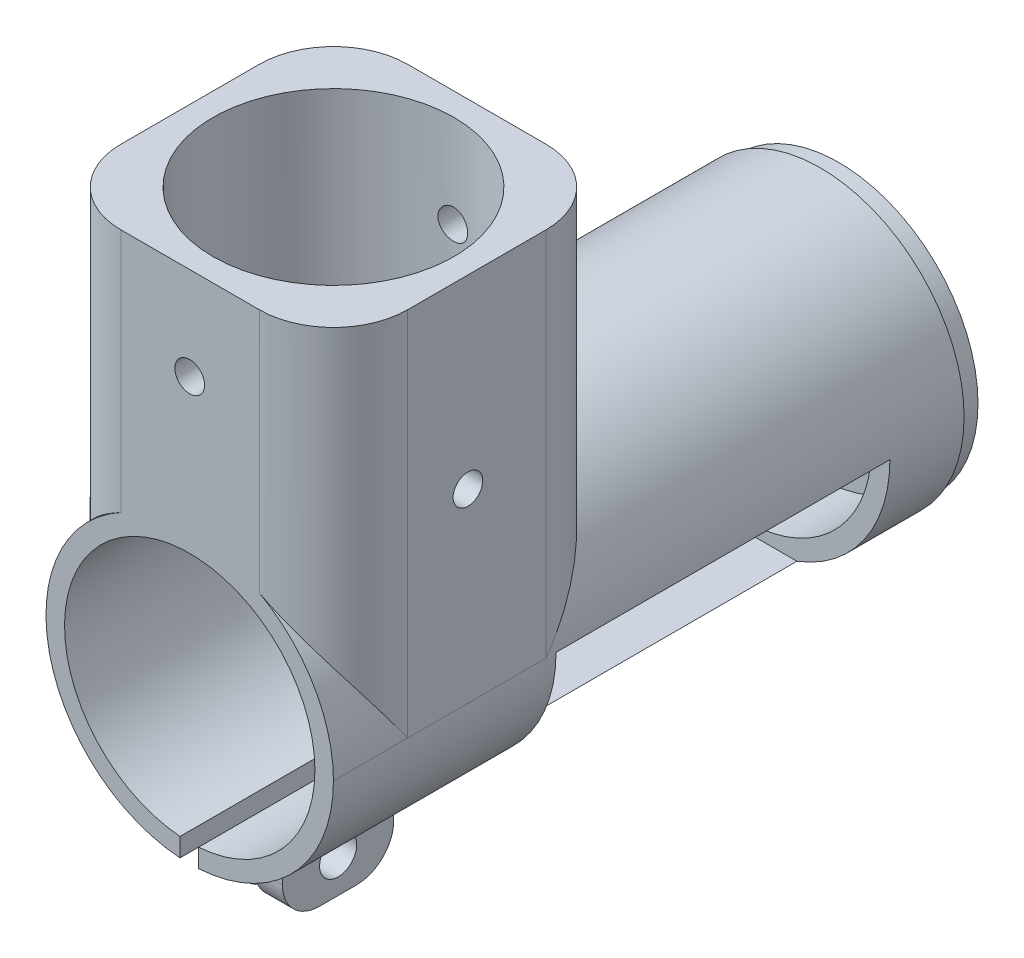
from build123d import *
from build123d.topology import SkipClean

# Parameters (mm, degrees)
SKETCH_1_R               = 15.5
SKETCH_1_R_2             = 13.5
EXTRUDE_1_DEPTH          = 68
SKETCH_2_R               = 15
SKETCH_2_R_2             = 1.6
SKETCH_2_R_3             = 5
EXTRUDE_2_DEPTH          = 2
SKETCH_3_R               = 13
EXTRUDE_3_DEPTH          = 40
SKETCH_4_R               = 12.5
CUT_EXTRUDE_1_DEPTH      = 40
SKETCH_5_R               = 1.6
CUT_EXTRUDE_4_DEPTH      = 81.400559864
CUT_EXTRUDE_5_DEPTH      = 40
CUT_EXTRUDE_5_DEPTH_BACK = 40
SKETCH_6_R               = 1.6
CUT_EXTRUDE_6_DEPTH      = 81.400559864
CUT_EXTRUDE_6_DEPTH_BACK = 81.400559864
SKETCH_7_W               = 36
SKETCH_7_H               = 14.5
SKETCH_8_W               = 2
SKETCH_8_H               = 10.589049083
CUT_EXTRUDE_7_DEPTH      = 40
EXTRUDE_4_DEPTH          = 6
EXTRUDE_4_DEPTH_BACK     = 6
SKETCH_9_W               = 3.9529011
SKETCH_9_H               = 9.000605057
SKETCH_9_W_2             = 3.0470989
SKETCH_9_H_2             = 8.993608177
SKETCH_10_R              = 2
CUT_EXTRUDE_8_DEPTH      = 82.266536936
CUT_EXTRUDE_9_DEPTH      = 2
FILLET_1_R               = 4
CUT_EXTRUDE_START        = -68
SKETCH_13_R              = 13.5
CUT_EXTRUDE_10_DEPTH     = 68


with BuildPart() as part:
    # Эскиз1 → Бобышка-Вытянуть1 (new body)
    with BuildSketch(Plane.XY):
        Circle(SKETCH_1_R)
        Circle(SKETCH_1_R_2, mode=Mode.SUBTRACT)
    extrude(amount=EXTRUDE_1_DEPTH)

    # Эскиз2 → Бобышка-Вытянуть2 (add)
    with BuildSketch(Plane(origin=(0, 0, 0), x_dir=(-1, 0, 0), z_dir=(0, 0, -1))):
        Circle(SKETCH_2_R)
        with Locations((8.5, 0)):
            Circle(SKETCH_2_R_2, mode=Mode.SUBTRACT)
        with Locations((-8.5, 0)):
            Circle(SKETCH_2_R_2, mode=Mode.SUBTRACT)
        Circle(SKETCH_2_R_3, mode=Mode.SUBTRACT)
    extrude(amount=EXTRUDE_2_DEPTH)

    # Эскиз3 → Бобышка-Вытянуть3 (add)
    with BuildSketch(Plane(origin=(0, 0, 0), x_dir=(1, 0, 0), z_dir=(0, 1, 0))):
        with BuildLine():
            Line((-7.417425678, -37.082574322), (7.5, -37.082574322))
            ThreePointArc((7.5, -37.082574322), (13.156854249, -39.425720072), (15.5, -45.082574322))
            Line((15.5, -45.082574322), (15.5, -60))
            ThreePointArc((15.5, -60), (13.156854249, -65.656854249), (7.5, -68))
            Line((7.5, -68), (-7.417425678, -68))
            ThreePointArc((-7.417425678, -68), (-13.074279928, -65.656854249), (-15.417425678, -60))
            Line((-15.417425678, -60), (-15.417425678, -45.082574322))
            ThreePointArc((-15.417425678, -45.082574322), (-13.074279928, -39.425720072), (-7.417425678, -37.082574322))
        make_face()
        with Locations(Location((0.041287161, -52.541287161, 0), (0, 0, 90))):
            Circle(SKETCH_3_R, mode=Mode.SUBTRACT)
    extrude(amount=EXTRUDE_3_DEPTH)

    # Эскиз4 → Вырез-Вытянуть1 (cut)
    with BuildSketch(Plane.XY.offset(68)):
        Circle(SKETCH_4_R)
    extrude(amount=-CUT_EXTRUDE_1_DEPTH, mode=Mode.SUBTRACT)

    # Эскиз5 → Вырез-Вытянуть4 (cut, through all)
    with BuildSketch(Plane.XY):
        with Locations(Location((0, 30, 0), (0, 0, 88.521348327))):
            Circle(SKETCH_5_R)
    extrude(amount=CUT_EXTRUDE_4_DEPTH, mode=Mode.SUBTRACT)

    # Эскиз6 → Вырез-Вытянуть5 (cut, two sides: drawn at the far end of the back side and taken through both)
    with BuildSketch(Plane(origin=(0, 0, 0), x_dir=(0, 0, -1), z_dir=(1, 0, 0)).offset(-CUT_EXTRUDE_5_DEPTH_BACK)):
        with Locations(Location((-53.5, 20, 0), (0, 0, 180))):
            Circle(SKETCH_6_R)
    extrude(amount=CUT_EXTRUDE_5_DEPTH + CUT_EXTRUDE_5_DEPTH_BACK, mode=Mode.SUBTRACT)

    # Эскиз7 → Вырез-Вытянуть6 (cut, two sides: drawn at the far end of the back side and taken through both)
    with BuildSketch(Plane(origin=(0, 0, 0), x_dir=(0, 0, -1), z_dir=(1, 0, 0)).offset(-CUT_EXTRUDE_6_DEPTH_BACK)):
        with Locations((-26, -7.25)):
            Rectangle(SKETCH_7_W, SKETCH_7_H)
    extrude(amount=CUT_EXTRUDE_6_DEPTH + CUT_EXTRUDE_6_DEPTH_BACK, mode=Mode.SUBTRACT)

    # Эскиз8 → Вырез-Вытянуть7 (cut)
    with BuildSketch(Plane.XY.offset(68)):
        with Locations((-0.0470989, -15.499928442)):
            Rectangle(SKETCH_8_W, SKETCH_8_H)
    extrude(amount=-CUT_EXTRUDE_7_DEPTH, mode=Mode.SUBTRACT)

    # Эскиз9 → Бобышка-Вытянуть4 (add, two sides: drawn at the far end of the back side and taken through both)
    with BuildSketch(Plane(origin=(0, 0, 56), x_dir=(-1, 0, 0), z_dir=(0, 0, -1)).offset(-EXTRUDE_4_DEPTH_BACK)):
        with Locations((3.02354945, -17.959633265)):
            Rectangle(SKETCH_9_W, SKETCH_9_H)
        with Locations((-2.47645055, -17.963131706)):
            Rectangle(SKETCH_9_W_2, SKETCH_9_H_2)
    extrude(amount=EXTRUDE_4_DEPTH + EXTRUDE_4_DEPTH_BACK)

    # Эскиз10 → Вырез-Вытянуть8 (cut, through all)
    with BuildSketch(Plane(origin=(4, 0, 0), x_dir=(0, 0, -1), z_dir=(1, 0, 0))):
        with Locations(Location((-56, -18.717457463, 0), (0, 0, 90))):
            Circle(SKETCH_10_R)
    extrude(amount=-CUT_EXTRUDE_8_DEPTH, mode=Mode.SUBTRACT)

    # Эскиз11 → Вырез-Вытянуть9 (cut)
    with BuildSketch(Plane.ZY.offset(5)):
        Polygon((60.041451884, -18.717457463), (58.020725942, -15.217457463), (53.979274058, -15.217457463), (51.958548116, -18.717457463), (53.979274058, -22.217457463), (58.020725942, -22.217457463), align=None)
    extrude(amount=-CUT_EXTRUDE_9_DEPTH, mode=Mode.SUBTRACT)

    # Скругление1
    fillet_1_edges = [part.edges().sort_by_distance(p)[0] for p in [
        (-3.02354945, -22.459935794, 50),
        (-3.02354945, -22.459935794, 62),
        (2.47645055, -22.459935794, 50),
        (2.47645055, -22.459935794, 62),
    ]]
    fillet(fillet_1_edges, radius=FILLET_1_R)

    # Эскиз13 → Вырез-Вытянуть10 (cut)
    with SkipClean():  # the faces are left unmerged after this step: merging them gives an invalid solid
        with BuildSketch(Plane.XY.offset(68).offset(CUT_EXTRUDE_START)):
            Circle(SKETCH_13_R)
        extrude(amount=CUT_EXTRUDE_10_DEPTH, mode=Mode.SUBTRACT)


solid = part.part
